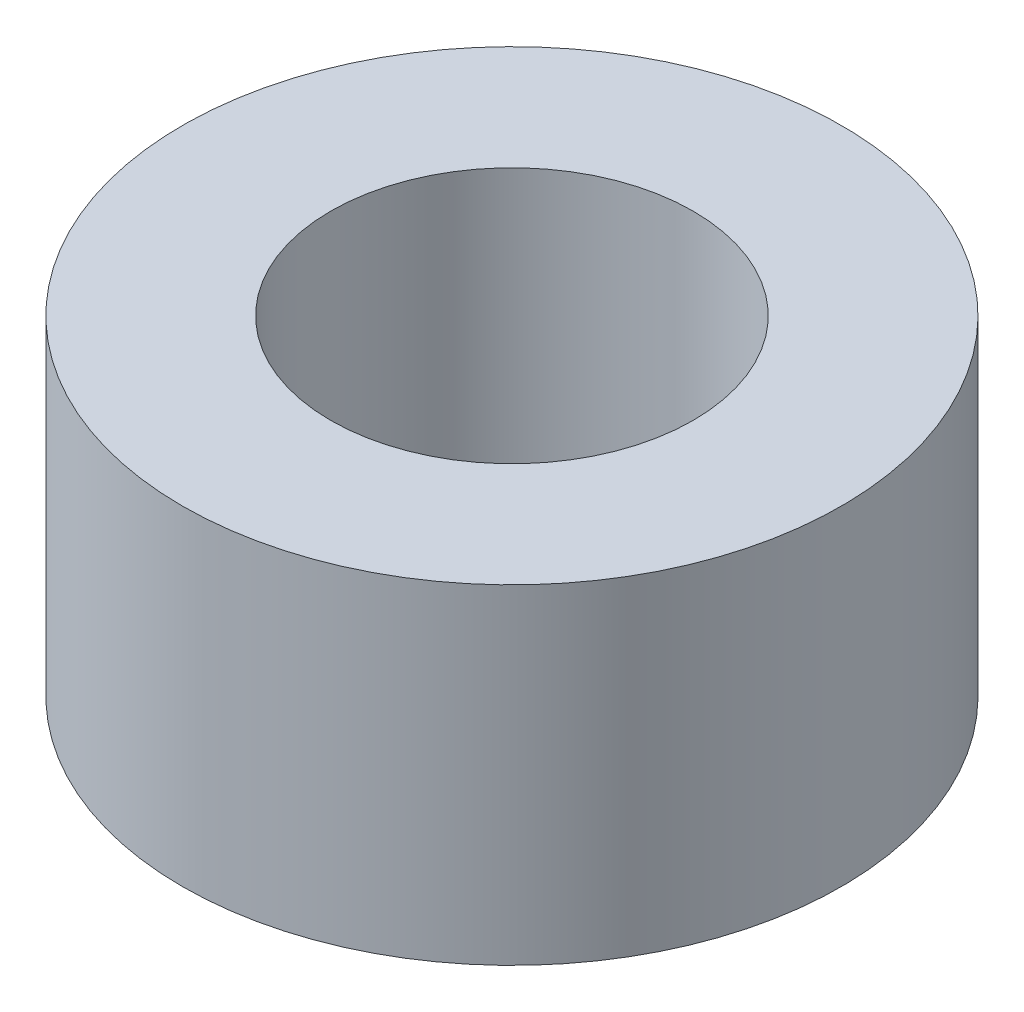
from build123d import *

# Parameters (mm, degrees)
SKETCH_1_R      = 3
SKETCH_1_R_2    = 1.65
EXTRUDE_1_DEPTH = 3


with BuildPart() as part:
    # 草图1 → 凸台-拉伸1 (new body)
    with BuildSketch(Plane(origin=(0, 0, 0), x_dir=(1, 0, 0), z_dir=(0, 1, 0))):
        with Locations(Location((0, 0, 0), (0, 0, 270))):
            Circle(SKETCH_1_R)
        with Locations(Location((0, 0, 0), (0, 0, 270))):
            Circle(SKETCH_1_R_2, mode=Mode.SUBTRACT)
    extrude(amount=EXTRUDE_1_DEPTH)


solid = part.part
